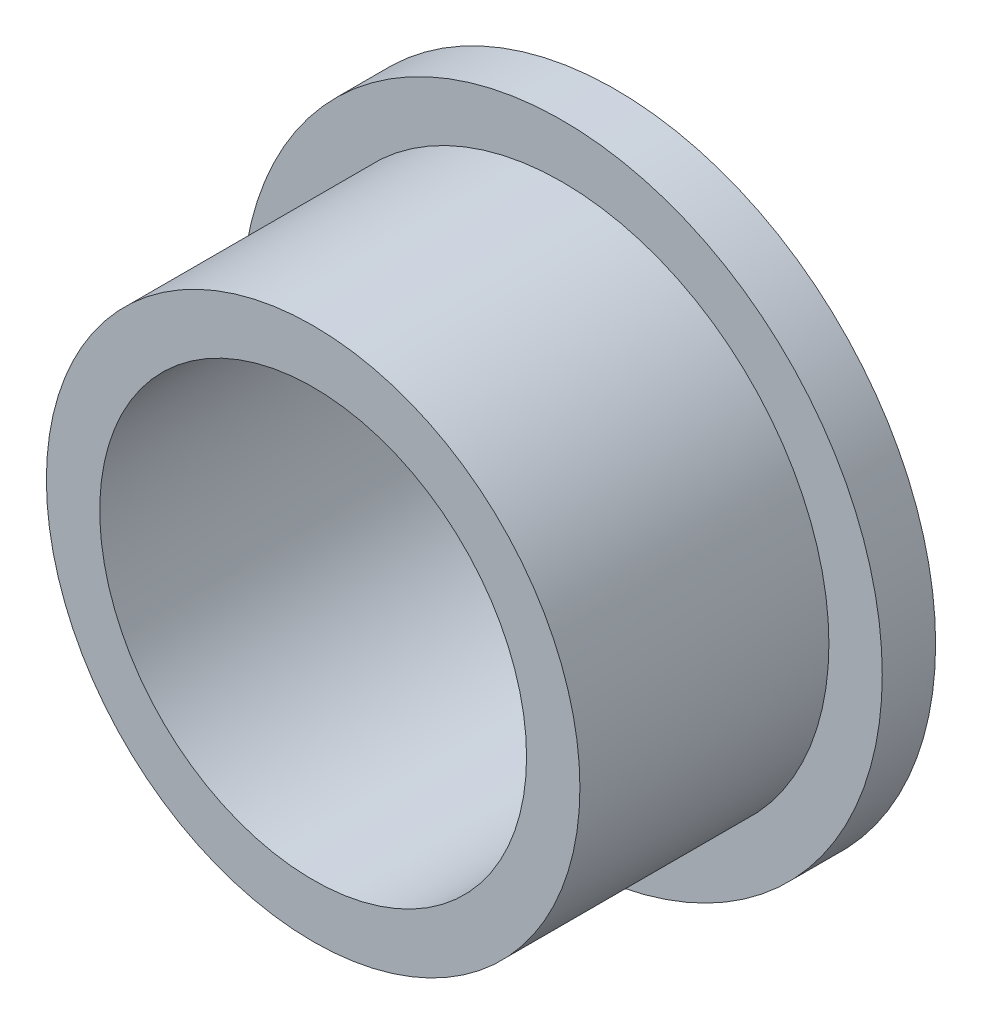
from build123d import *


with BuildPart() as part:
    # Sketch1 → Revolve1 (revolve)
    with BuildSketch(Plane(origin=(0, 0, 0), x_dir=(1, 0, 0), z_dir=(0, 1, 0))):
        Polygon((12, 0), (12, 17), (18, 17), (18, 14), (15, 14), (15, 0), align=None)
    revolve(axis=Axis((0, 0, 0), (0, 0, -1)))


solid = part.part
